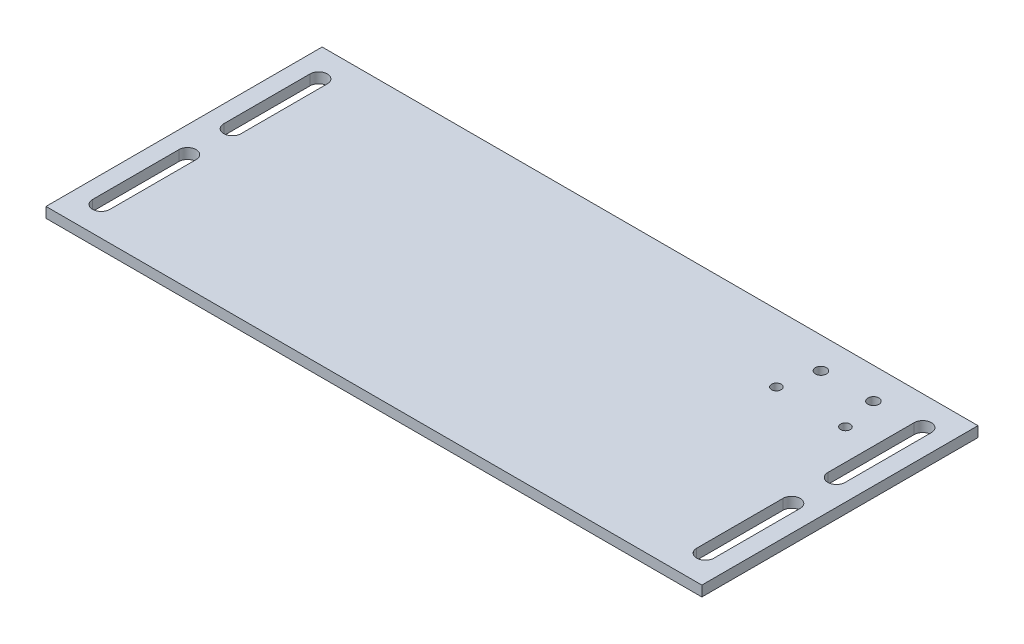
from build123d import *

# Parameters (mm, degrees)
SKETCH1_W           = 190
SKETCH1_H           = 80
BOSS_EXTRUDE1_DEPTH = 3
SKETCH4_R           = 1.4
SKETCH4_R_2         = 1.6
CUT_EXTRUDE2_DEPTH  = 3


with BuildPart() as part:
    # Sketch1 → Boss-Extrude1 (new body)
    with BuildSketch(Plane(origin=(0, 0, 0), x_dir=(1, 0, 0), z_dir=(0, 1, 0))):
        Rectangle(SKETCH1_W, SKETCH1_H)
        with BuildLine():
            Line((-90, 6.5), (-90, 31.5))
            ThreePointArc((-90, 31.5), (-87.5, 34), (-85, 31.5))
            Line((-85, 31.5), (-85, 6.5))
            ThreePointArc((-85, 6.5), (-87.5, 4), (-90, 6.5))
        make_face(mode=Mode.SUBTRACT)
        with BuildLine():
            Line((-90, -6.5), (-90, -31.5))
            ThreePointArc((-90, -31.5), (-87.5, -34), (-85, -31.5))
            Line((-85, -31.5), (-85, -6.5))
            ThreePointArc((-85, -6.5), (-87.5, -4), (-90, -6.5))
        make_face(mode=Mode.SUBTRACT)
        with BuildLine():
            Line((90, 6.5), (90, 31.5))
            ThreePointArc((90, 31.5), (87.5, 34), (85, 31.5))
            Line((85, 31.5), (85, 6.5))
            ThreePointArc((85, 6.5), (87.5, 4), (90, 6.5))
        make_face(mode=Mode.SUBTRACT)
        with BuildLine():
            Line((90, -6.5), (90, -31.5))
            ThreePointArc((90, -31.5), (87.5, -34), (85, -31.5))
            Line((85, -31.5), (85, -6.5))
            ThreePointArc((85, -6.5), (87.5, -4), (90, -6.5))
        make_face(mode=Mode.SUBTRACT)
    extrude(amount=BOSS_EXTRUDE1_DEPTH)

    # Sketch4 → Cut-Extrude2 (cut)
    with BuildSketch(Plane(origin=(0, 3, 0), x_dir=(1, 0, 0), z_dir=(0, 1, 0))):
        with Locations(Location((56.1, 20.5, 0), (0, 0, 270))):
            Circle(SKETCH4_R)
        with Locations(Location((76.1, 20.5, 0), (0, 0, 270))):
            Circle(SKETCH4_R)
        with Locations(Location((58.495, 31, 0), (0, 0, 270))):
            Circle(SKETCH4_R_2)
        with Locations(Location((73.705, 31, 0), (0, 0, 270))):
            Circle(SKETCH4_R_2)
    extrude(amount=-CUT_EXTRUDE2_DEPTH, mode=Mode.SUBTRACT)


solid = part.part
